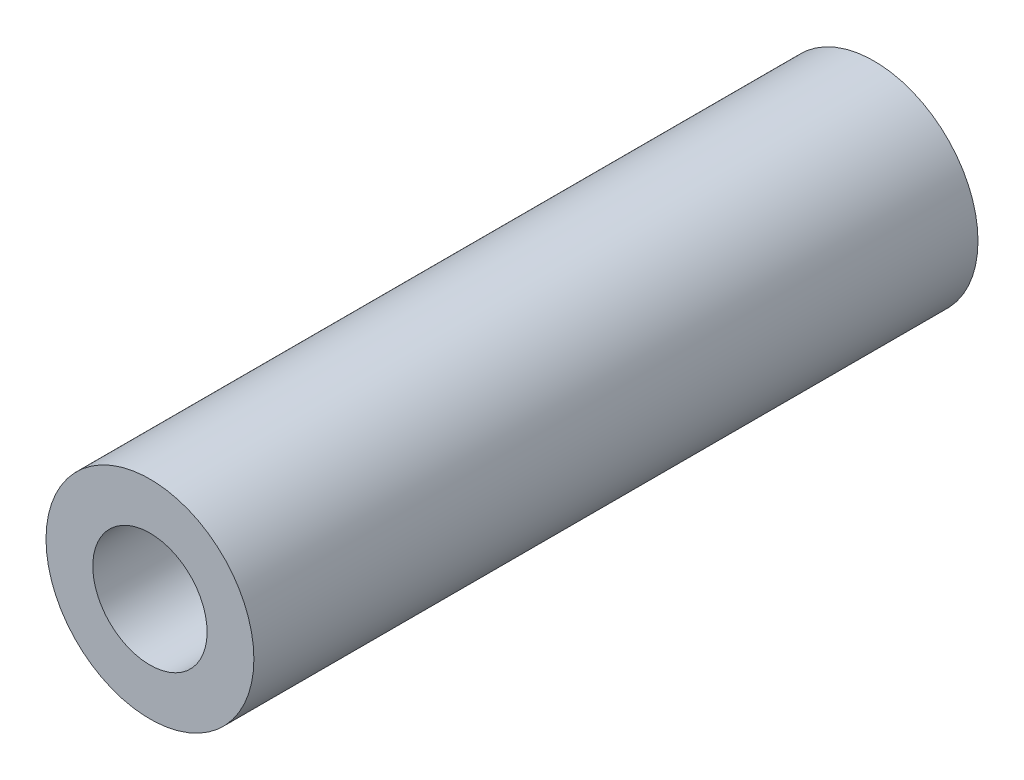
from build123d import *

# Parameters (mm, degrees)
SKETCH1_R            = 6
BOSS_EXTRUDE1_DEPTH  = 41.8
M6_CLEARANCE_HOLE1_D = 6.6


with BuildPart() as part:
    # Sketch1 → Boss-Extrude1 (new body)
    with BuildSketch(Plane.XY):
        Circle(SKETCH1_R)
    extrude(amount=BOSS_EXTRUDE1_DEPTH)

    # M6 Clearance Hole1 (through all)
    with Locations(Plane.XY.offset(41.8)):
        with Locations((0, 0)):
            Hole(M6_CLEARANCE_HOLE1_D / 2)


solid = part.part
